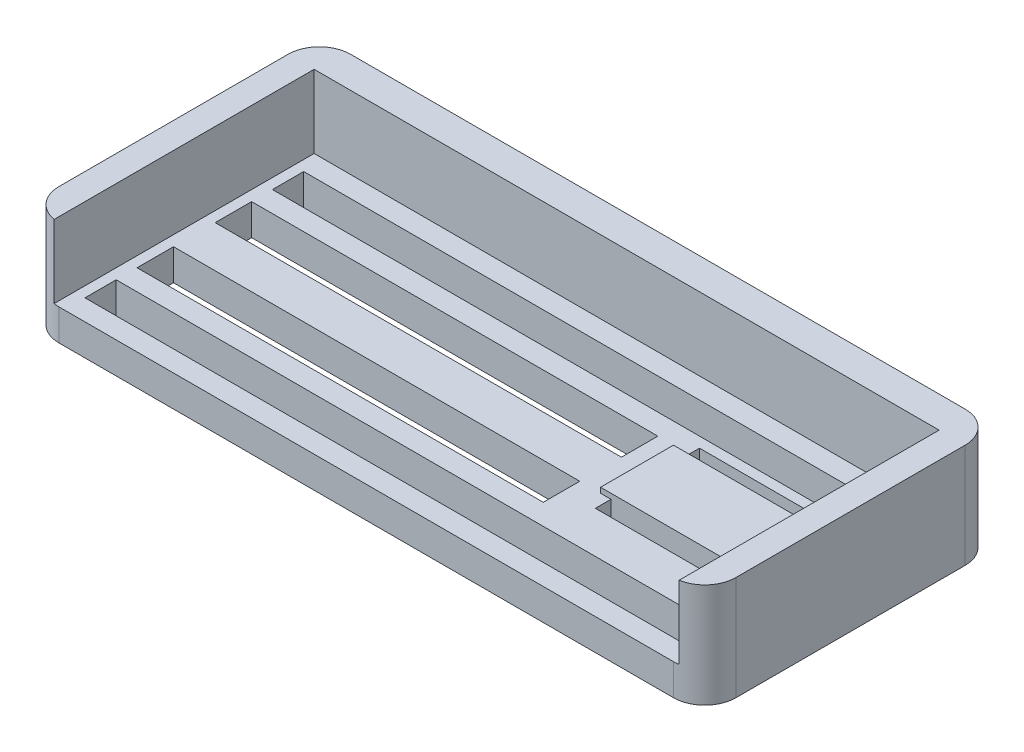
from build123d import *

# Parameters (mm, degrees)
SKETCH1_W           = 65
SKETCH1_H           = 28
BOSS_EXTRUDE1_DEPTH = 10
CUT_EXTRUDE1_DEPTH  = 7
SKETCH3_W           = 10
SKETCH3_H           = 10
CUT_EXTRUDE2_DEPTH  = 7
BOSS_EXTRUDE5_DEPTH = 6
CUT_EXTRUDE6_DEPTH  = 1
SKETCH6_W           = 58
SKETCH6_H           = 3
SKETCH6_W_2         = 39
SKETCH6_H_2         = 3.5
CUT_EXTRUDE7_DEPTH  = 41
FILLET1_R           = 3


with BuildPart() as part:
    # Sketch1 → Boss-Extrude1 (new body)
    with BuildSketch(Plane(origin=(0, 0, 0), x_dir=(1, 0, 0), z_dir=(0, 1, 0))):
        Rectangle(SKETCH1_W, SKETCH1_H)
    extrude(amount=BOSS_EXTRUDE1_DEPTH)

    # Sketch2 → Cut-Extrude1 (cut)
    with BuildSketch(Plane(origin=(0, 10, 0), x_dir=(1, 0, 0), z_dir=(0, 1, 0))):
        Polygon((30, -11), (30, 11), (-30, 11), (-30, -11), (-30, -14), (30, -14), align=None)
    extrude(amount=-CUT_EXTRUDE1_DEPTH, mode=Mode.SUBTRACT)

    # Sketch3 → Cut-Extrude2 (cut)
    with BuildSketch(Plane(origin=(0, 3, 0), x_dir=(1, 0, 0), z_dir=(0, 1, 0))):
        with Locations((18, 0)):
            Rectangle(SKETCH3_W, SKETCH3_H)
    extrude(amount=-CUT_EXTRUDE2_DEPTH, mode=Mode.SUBTRACT)

    # Sketch4 → Boss-Extrude5 (add, symmetric)
    with BuildSketch(Plane(origin=(18, 0, 0), x_dir=(0, 0, -1), z_dir=(1, 0, 0))):
        with BuildLine():
            Line((-3.5, -3.5), (-2.121320344, -2.121320344))
            ThreePointArc((-2.121320344, -2.121320344), (0, 3), (2.121320344, -2.121320344))
            Line((2.121320344, -2.121320344), (3.5, -3.5))
            Line((3.5, -3.5), (3.5, 3.5))
            Line((3.5, 3.5), (-3.5, 3.5))
            Line((-3.5, 3.5), (-3.5, -3.5))
        make_face()
    extrude(amount=BOSS_EXTRUDE5_DEPTH, both=True)

    # Sketch5 → Cut-Extrude6 (cut)
    with BuildSketch(Plane.ZY.offset(-23)):
        with BuildLine():
            Line((-2.898275349, 0.1), (2.898275349, 0.1))
            ThreePointArc((2.898275349, 0.1), (0, 2.9), (-2.898275349, 0.1))
        make_face()
    cut_extrude6 = extrude(amount=-CUT_EXTRUDE6_DEPTH, mode=Mode.SUBTRACT)

    # Mirror1: Cut-Extrude6 across plane
    add(cut_extrude6.mirror(Plane(origin=(18, 0, 0), x_dir=(0, 0, 1), z_dir=(1, 0, 0))), mode=Mode.SUBTRACT)

    # Sketch6 → Cut-Extrude7 (cut)
    with BuildSketch(Plane(origin=(0, 3, 0), x_dir=(1, 0, 0), z_dir=(0, 1, 0))):
        with Locations((0, 7.5)):
            Rectangle(SKETCH6_W, SKETCH6_H)
        with Locations((-9.5, 2.25)):
            Rectangle(SKETCH6_W_2, SKETCH6_H_2)
        with Locations((-9.5, -5.25)):
            Rectangle(SKETCH6_W_2, SKETCH6_H_2)
        with Locations((0, -10.5)):
            Rectangle(SKETCH6_W, SKETCH6_H)
    extrude(amount=-CUT_EXTRUDE7_DEPTH, mode=Mode.SUBTRACT)

    # Fillet1
    fillet1_edges = [part.edges().sort_by_distance(p)[0] for p in [
        (32.5, 5, 14),
        (-32.5, 5, 14),
        (-32.5, 5, -14),
        (32.5, 5, -14),
    ]]
    fillet(fillet1_edges, radius=FILLET1_R)


solid = part.part
